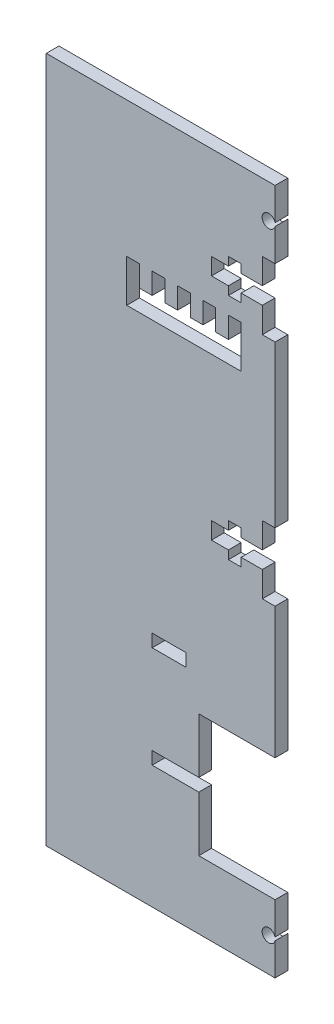
from build123d import *

# Parameters (mm, degrees)
SKETCH_1_W      = 8
SKETCH_1_H      = 3
EXTRUDE_1_DEPTH = 3


with BuildPart() as part:
    # 草图1 → 凸台-拉伸1 (new body)
    with BuildSketch(Plane.XY):
        with BuildLine():
            Line((0, 140), (0, 146))
            Line((0, 146), (3, 146))
            Line((3, 146), (3, 153.609487516))
            ThreePointArc((3, 153.609487516), (-0.05, 154), (3, 154.390512484))
            Line((3, 154.390512484), (3, 162))
            Line((3, 162), (0, 162))
            Line((0, 162), (-51, 162))
            Line((-51, 162), (-51, 0))
            Line((-51, 0), (0, 0))
            Line((0, 0), (3, 0))
            Line((3, 0), (3, 7.609487516))
            ThreePointArc((3, 7.609487516), (-0.05, 8), (3, 8.390512484))
            Line((3, 8.390512484), (3, 16))
            Line((3, 16), (0, 16))
            Line((0, 16), (-15, 16))
            Line((-15, 16), (-15, 29))
            Line((-15, 29), (-18, 29))
            Line((-18, 29), (-26, 29))
            Line((-26, 29), (-26, 32))
            Line((-26, 32), (-18, 32))
            Line((-18, 32), (-15, 32))
            Line((-15, 32), (-15, 45))
            Line((-15, 45), (0, 45))
            Line((0, 45), (3, 45))
            Line((3, 45), (3, 76))
            Line((3, 76), (0, 76))
            Line((0, 76), (0, 82))
            Line((0, 82), (-5, 82))
            Line((-5, 82), (-5, 80))
            Line((-5, 80), (-8, 80))
            Line((-8, 80), (-8, 82))
            Line((-8, 82), (-12, 82))
            Line((-12, 82), (-12, 86))
            Line((-12, 86), (-8, 86))
            Line((-8, 86), (-8, 88))
            Line((-8, 88), (-5, 88))
            Line((-5, 88), (-5, 86))
            Line((-5, 86), (0, 86))
            Line((0, 86), (0, 92))
            Line((0, 92), (3, 92))
            Line((3, 92), (3, 130))
            Line((3, 130), (0, 130))
            Line((0, 130), (0, 136))
            Line((0, 136), (-5, 136))
            Line((-5, 136), (-5, 134))
            Line((-5, 134), (-8, 134))
            Line((-8, 134), (-8, 136))
            Line((-8, 136), (-12, 136))
            Line((-12, 136), (-12, 140))
            Line((-12, 140), (-8, 140))
            Line((-8, 140), (-8, 142))
            Line((-8, 142), (-5, 142))
            Line((-5, 142), (-5, 140))
            Line((-5, 140), (0, 140))
        make_face()
        with Locations((-22, 54.5)):
            Rectangle(SKETCH_1_W, SKETCH_1_H, mode=Mode.SUBTRACT)
        Polygon((-11, 125), (-8, 125), (-8, 130), (-5, 130), (-5, 120), (-32, 120), (-32, 130), (-29, 130), (-29, 125), (-26, 125), (-26, 130), (-23, 130), (-23, 125), (-20, 125), (-20, 130), (-17, 130), (-17, 125), (-14, 125), (-14, 130), (-11, 130), align=None, mode=Mode.SUBTRACT)
    extrude(amount=EXTRUDE_1_DEPTH)


solid = part.part
